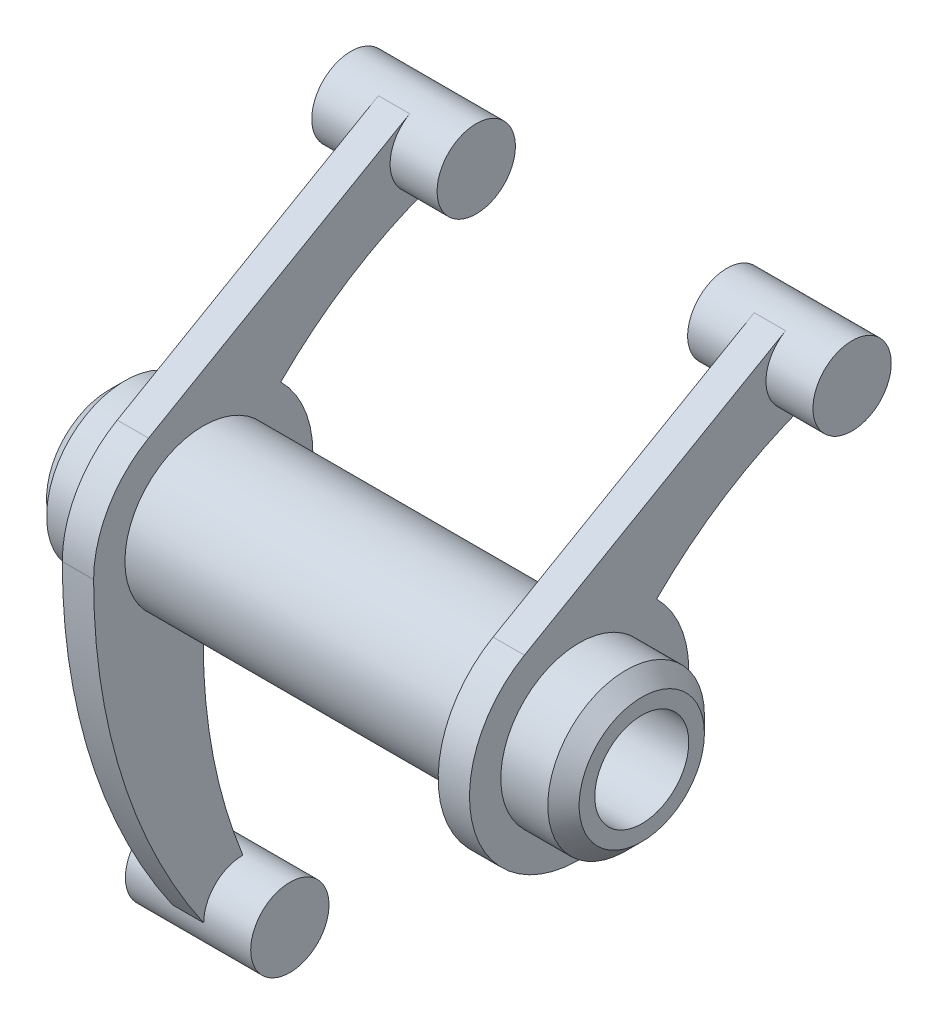
from build123d import *

# Parameters (mm, degrees)
SKETCH1_R                = 2.5
BOSS_EXTRUDE1_DEPTH      = 4
SKETCH1_3_R              = 5
BOSS_EXTRUDE2_DEPTH      = 1
BOSS_EXTRUDE3_DEPTH      = 6
BOSS_EXTRUDE3_DEPTH_BACK = 28
BOSS_EXTRUDE3_START      = -1
SKETCH1_4_R              = 5
SKETCH1_4_R_2            = 3
SKETCH2_R                = 5
BOSS_EXTRUDE6_DEPTH      = 2
BOSS_EXTRUDE7_DEPTH      = 5
BOSS_EXTRUDE7_DEPTH_BACK = 3
SKETCH2_5_R              = 2.5
CHAMFER1_SIZE            = 1


with BuildPart() as part:
    # Sketch1 → Boss-Extrude1 (new, symmetric)
    with BuildSketch(Plane.YZ):
        with Locations(Location((13.5, -14.43, 0), (0, 0, 270))):
            Circle(SKETCH1_R)
    extrude(amount=BOSS_EXTRUDE1_DEPTH, both=True)

    # Sketch1<3> → Boss-Extrude2 (add, symmetric)
    with BuildSketch(Plane.YZ):
        with BuildLine():
            Line((15.666598525, -13.182662503), (6.06647587, 3.492544992))
            ThreePointArc((6.06647587, 3.492544992), (-6.939551113, 0.917948988), (4.949747468, -4.949747468))
            ThreePointArc((4.949747468, -4.949747468), (8.491768153, -9.35999415), (11, -14.43))
            ThreePointArc((11, -14.43), (12.854436801, -12.014788176), (15.666598525, -13.182662503))
        make_face()
        with Locations(Location((0, 0, 0), (0, 0, 270))):
            Circle(SKETCH1_3_R, mode=Mode.SUBTRACT)
    extrude(amount=BOSS_EXTRUDE2_DEPTH, both=True)

    # Sketch1<4> → Boss-Extrude3 (add, two sides: drawn at the far end of the back side and taken through both)
    with BuildSketch(Plane.YZ.offset(BOSS_EXTRUDE3_START - BOSS_EXTRUDE3_DEPTH_BACK)):
        with Locations(Location((0, 0, 0), (0, 0, 270))):
            Circle(SKETCH1_4_R)
        with Locations(Location((0, 0, 0), (0, 0, 270))):
            Circle(SKETCH1_4_R_2, mode=Mode.SUBTRACT)
    extrude(amount=BOSS_EXTRUDE3_DEPTH + BOSS_EXTRUDE3_DEPTH_BACK)

    # Sketch2 → Boss-Extrude6 (add)
    # profile 1 of 2: a face of its own
    with BuildSketch(Plane(origin=(-23, 0, 0), x_dir=(0, -1, 0), z_dir=(-1, 0, 0))):
        with BuildLine():
            ThreePointArc((-9.4233e-05, 6.999999999), (-3.50376631, 6.060001786), (-6.06647587, 3.492544992))
            Line((-6.06647587, 3.492544992), (-15.666598525, -13.182662503))
            ThreePointArc((-15.666598525, -13.182662503), (-12.854436801, -12.014788176), (-11, -14.43))
            ThreePointArc((-11, -14.43), (-8.491768153, -9.35999415), (-4.949747468, -4.949747468))
            ThreePointArc((-4.949747468, -4.949747468), (2.678784027, -6.467156728), (7, 0))
            ThreePointArc((7, 0), (4.949714152, 4.949780784), (-9.4233e-05, 6.999999999))
        make_face()
        with Locations(Location((0, 0, 0), (0, 0, 270))):
            Circle(SKETCH2_R, mode=Mode.SUBTRACT)
    # profile 2 of 2: a face of its own
    with BuildSketch(Plane(origin=(-23, 0, 0), x_dir=(0, -1, 0), z_dir=(-1, 0, 0))):
        with BuildLine():
            ThreePointArc((22.5, -0.03), (11.786311318, 5.201659363), (-9.4233e-05, 6.999999999))
            ThreePointArc((-9.4233e-05, 6.999999999), (4.949714152, 4.949780784), (7, 0))
            ThreePointArc((7, 0), (13.62196533, -0.638300674), (20, -2.53))
            ThreePointArc((20, -2.53), (20.732233047, -0.762233047), (22.5, -0.03))
        make_face()
    extrude(amount=BOSS_EXTRUDE6_DEPTH)

    # Sketch2<5> → Boss-Extrude7 (add, two sides: drawn at the far end of the back side and taken through both)
    with BuildSketch(Plane(origin=(-23, 0, 0), x_dir=(0, -1, 0), z_dir=(-1, 0, 0)).offset(-BOSS_EXTRUDE7_DEPTH_BACK)):
        with Locations(Location((22.5, -2.53, 0), (0, 0, 90))):
            Circle(SKETCH2_5_R)
        with Locations(Location((-13.5, -14.43, 0), (0, 0, 270))):
            Circle(SKETCH2_5_R)
    extrude(amount=BOSS_EXTRUDE7_DEPTH + BOSS_EXTRUDE7_DEPTH_BACK)

    # Chamfer1
    chamfer1_edges = [part.edges().sort_by_distance(p)[0] for p in [
        (-29, 0, 5),
        (5, 0, 5),
    ]]
    chamfer(chamfer1_edges, length=CHAMFER1_SIZE)


solid = part.part
